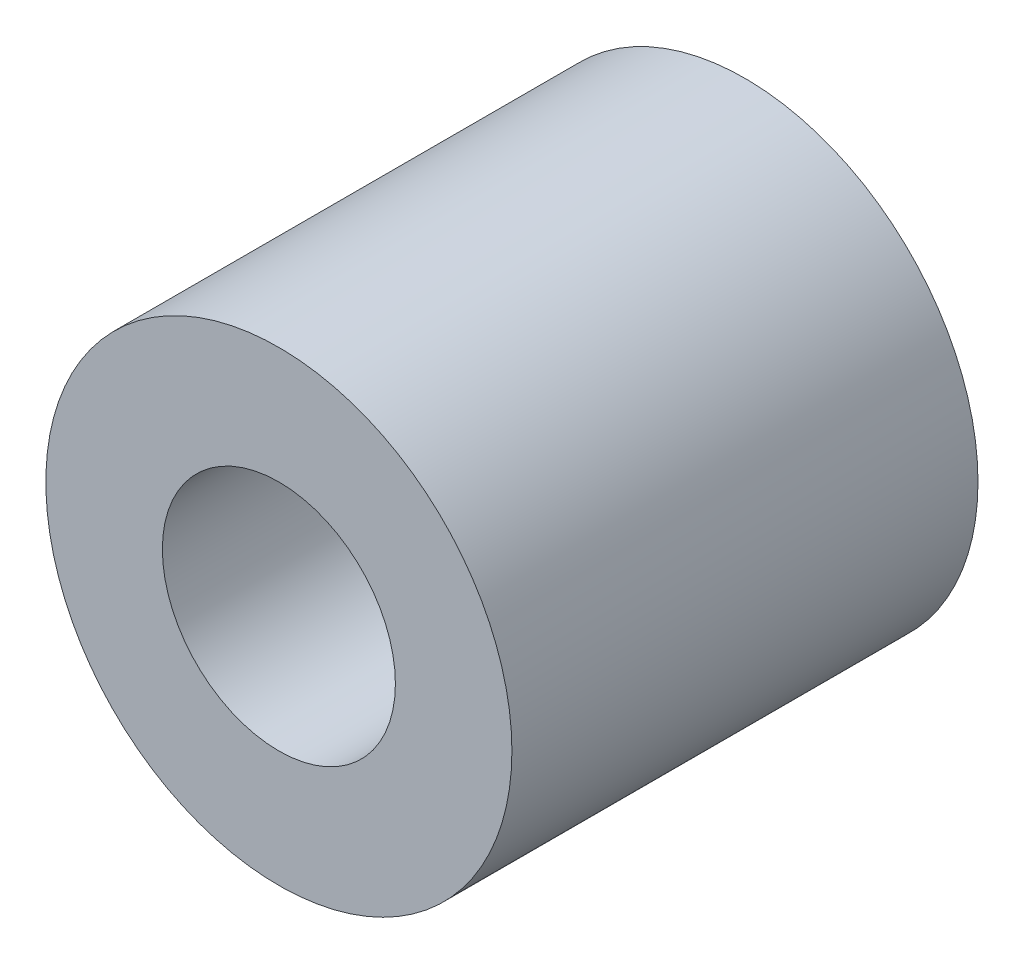
from build123d import *

# Parameters (mm, degrees)
SKETCH_1_R          = 8
EXTRUDE_1_DEPTH     = 16
SKETCH_2_R          = 2.5
CUT_EXTRUDE_1_DEPTH = 16
SKETCH_3_R          = 4
CUT_EXTRUDE_2_DEPTH = 8


with BuildPart() as part:
    # 草图1 → 凸台-拉伸1 (new body)
    with BuildSketch(Plane.XY):
        Circle(SKETCH_1_R)
    extrude(amount=EXTRUDE_1_DEPTH)

    # 草图2 → 切除-拉伸1 (cut)
    with BuildSketch(Plane(origin=(0, 0, 0), x_dir=(-1, 0, 0), z_dir=(0, 0, -1))):
        Circle(SKETCH_2_R)
    extrude(amount=-CUT_EXTRUDE_1_DEPTH, mode=Mode.SUBTRACT)

    # 草图3 → 切除-拉伸2 (cut)
    with BuildSketch(Plane.XY.offset(16)):
        Circle(SKETCH_3_R)
    extrude(amount=-CUT_EXTRUDE_2_DEPTH, mode=Mode.SUBTRACT)


solid = part.part
